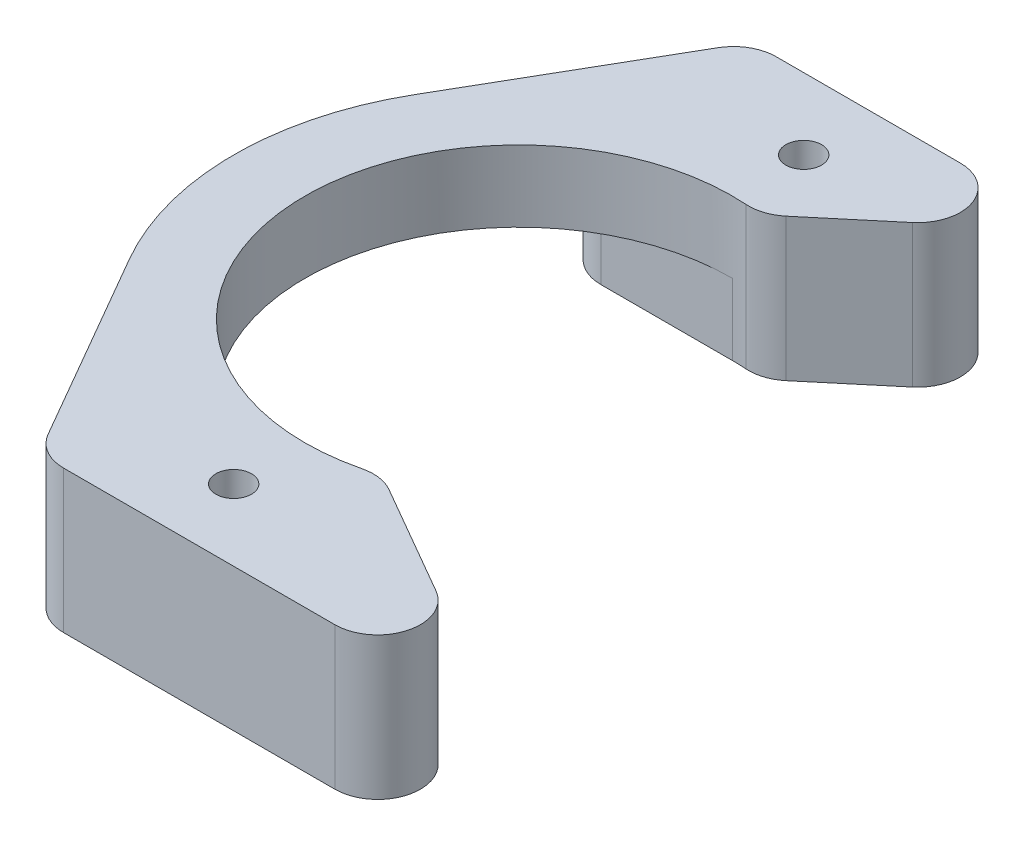
from build123d import *

# Parameters (mm, degrees)
EXTRUDE_1_DEPTH     = 10
HOLE_WIZARD_M3_1_D  = 2.5
CUT_EXTRUDE_1_DEPTH = 5
FILLET_1_R          = 3


with BuildPart() as part:
    # 草图1 → 凸台-拉伸1 (new body)
    with BuildSketch(Plane(origin=(0, 0, 0), x_dir=(1, 0, 0), z_dir=(0, 1, 0))):
        with BuildLine():
            ThreePointArc((-17.320508076, 10), (-6.840402867, 18.793852416), (6.840402867, 18.793852416))
            Line((6.840402867, 18.793852416), (14.236601546, 25))
            Line((14.236601546, 25), (-8.660254038, 25))
            Line((-8.660254038, 25), (-17.320508076, 10))
        make_face()
        with BuildLine():
            Line((2.136761146, 14.847028383), (6.840402867, 18.793852416))
            ThreePointArc((6.840402867, 18.793852416), (-19.923893962, -1.743114855), (10, -17.320508076))
            Line((10, -17.320508076), (4.682458366, -14.250423982))
            ThreePointArc((4.682458366, -14.250423982), (-14.942920471, -1.307336141), (2.136761146, 14.847028383))
        make_face()
        with BuildLine():
            Line((23.301270189, -25), (10, -17.320508076))
            ThreePointArc((10, -17.320508076), (-5.176380902, -19.318516526), (-17.320508076, -10))
            Line((-17.320508076, -10), (-8.660254038, -25))
            Line((-8.660254038, -25), (23.301270189, -25))
        make_face()
    extrude(amount=EXTRUDE_1_DEPTH)

    # M3 螺纹孔1 (through all)
    with Locations(Plane.XZ):
        with Locations((0, 20), (0, -20)):
            Hole(HOLE_WIZARD_M3_1_D / 2)

    # 草图4 → 切除-拉伸1 (cut)
    with BuildSketch(Plane.XZ):
        with BuildLine():
            Line((0, 15), (-14.43375673, 15))
            Line((-14.43375673, 15), (-17.320508076, 10))
            ThreePointArc((-17.320508076, 10), (-20, 0), (-17.320508076, -10))
            Line((-17.320508076, -10), (-14.43375673, -15))
            Line((-14.43375673, -15), (0, -15))
            Line((0, -15), (0, 15))
        make_face()
    extrude(amount=-CUT_EXTRUDE_1_DEPTH, mode=Mode.SUBTRACT)

    # 圆角1
    fillet_1_edges = [part.edges().sort_by_distance(p)[0] for p in [
        (-8.660254038, 5, -25),
        (14.236601546, 5, -25),
        (2.136761146, 5, -14.847028383),
        (4.682458366, 5, 14.250423982),
        (23.301270189, 5, 25),
        (-8.660254038, 5, 25),
        (-14.43375673, 2.5, -15),
        (-14.43375673, 2.5, 15),
    ]]
    fillet(fillet_1_edges, radius=FILLET_1_R)


solid = part.part
